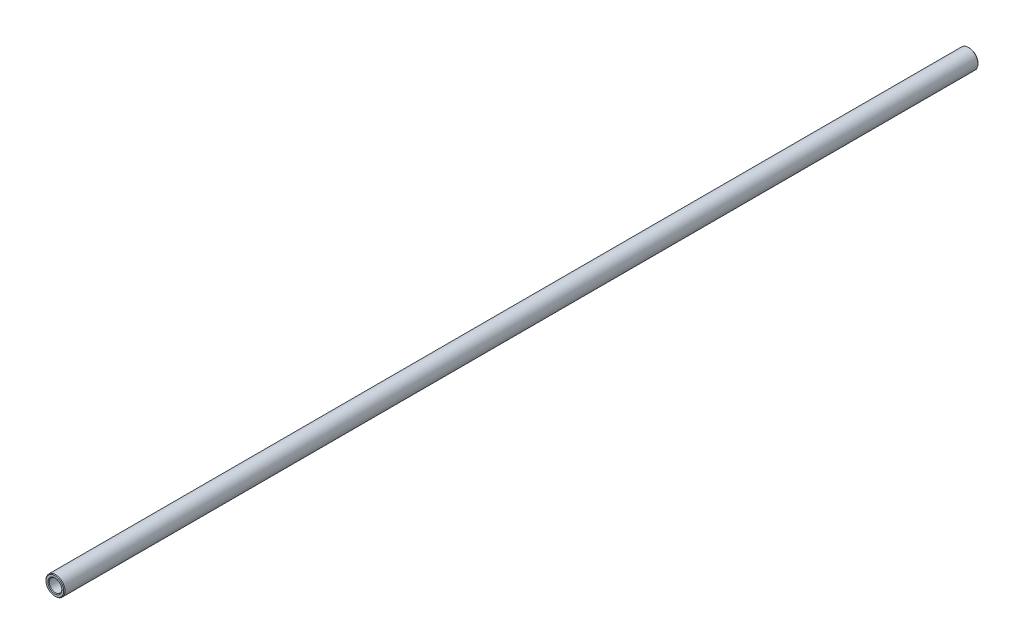
from build123d import *

# Parameters (mm, degrees)
BOSS_EXTRUDE1_DEPTH      = 152.4
BOSS_EXTRUDE1_DEPTH_BACK = 152.4
SKETCH3_R                = 3.175
SKETCH3_R_2              = 2.1082
CHAMFER1_SIZE            = 0.21336


with BuildPart() as part:
    # Sketch3 → Boss-Extrude1 (new, two sides: drawn at the far end of the back side and taken through both)
    with BuildSketch(Plane.XY.offset(-BOSS_EXTRUDE1_DEPTH_BACK)):
        Circle(SKETCH3_R)
        Circle(SKETCH3_R_2, mode=Mode.SUBTRACT)
    extrude(amount=BOSS_EXTRUDE1_DEPTH + BOSS_EXTRUDE1_DEPTH_BACK)

    # Chamfer1
    chamfer1_edges = [part.edges().sort_by_distance(p)[0] for p in [
        (-3.175, 0, -152.4),
        (-2.1082, 0, -152.4),
        (-3.175, 0, 152.4),
        (-2.1082, 0, 152.4),
    ]]
    chamfer(chamfer1_edges, length=CHAMFER1_SIZE)


solid = part.part
